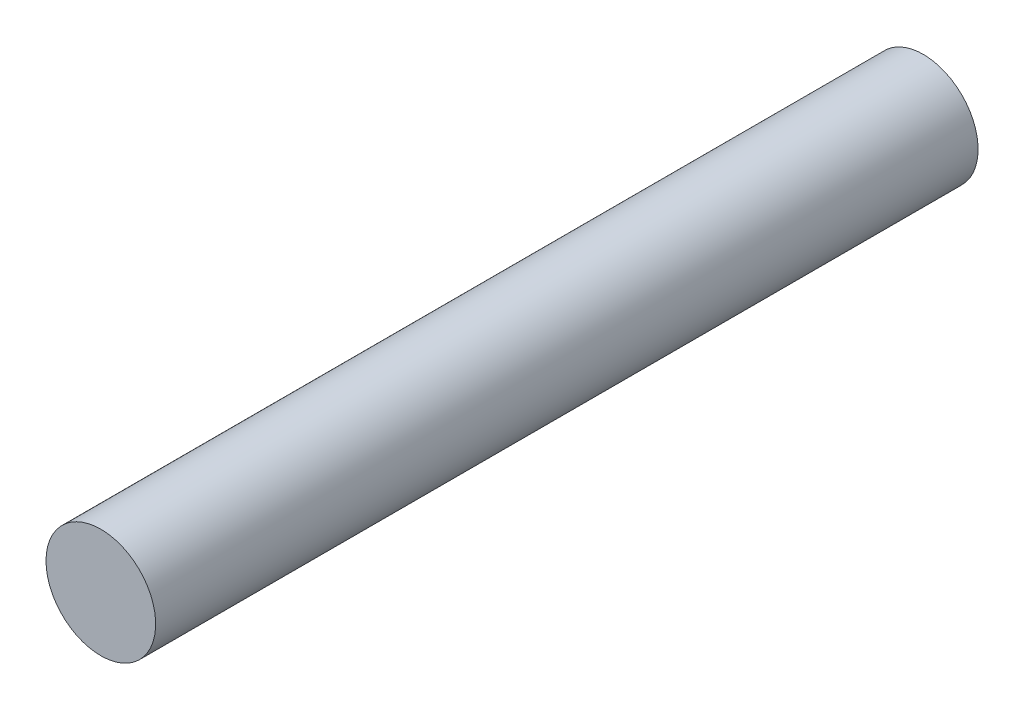
from build123d import *

# Parameters (mm, degrees)
SKETCH_1_R      = 3
EXTRUDE_1_DEPTH = 45


with BuildPart() as part:
    # 草图1 → 凸台-拉伸1 (new body)
    with BuildSketch(Plane.XY):
        with Locations(Location((0, 0, 0), (0, 0, 180))):
            Circle(SKETCH_1_R)
    extrude(amount=EXTRUDE_1_DEPTH)


solid = part.part
